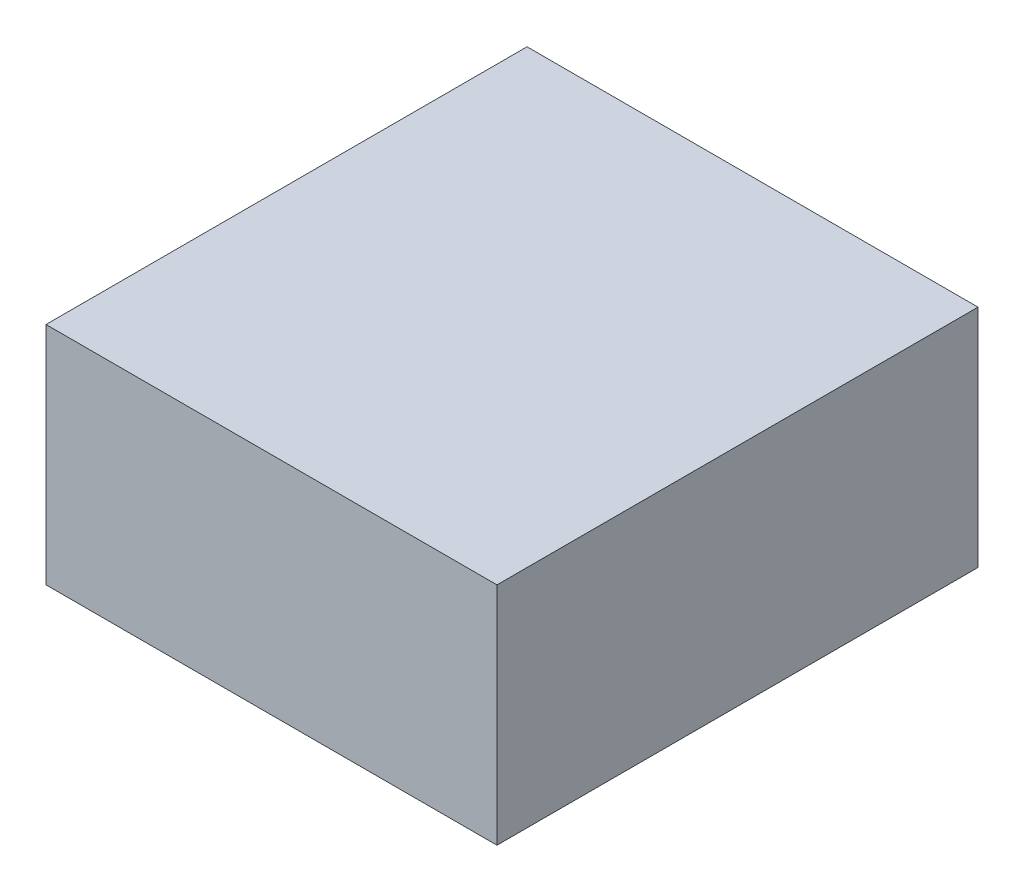
from build123d import *

# Parameters (mm, degrees)
SKETCH_1_W          = 300
SKETCH_1_H          = 150
EXTRUDE_1_DEPTH     = 160
CUT_EXTRUDE_1_DEPTH = 1


with BuildPart() as part:
    # 草图1 → 凸台-拉伸1 (new, symmetric)
    with BuildSketch(Plane.XY):
        Rectangle(SKETCH_1_W, SKETCH_1_H)
    extrude(amount=EXTRUDE_1_DEPTH, both=True)

    # 草图2 → 切除-拉伸1 (cut)
    with BuildSketch(Plane.ZY.offset(150)):
        with BuildLine():
            Line((-95.006009615, 17.135416667), (-50.114182692, 17.135416667))
            Line((-50.114182692, 17.135416667), (-46.057692308, 21.282051282))
            Line((-46.057692308, 21.282051282), (-40.378605769, 15.512820513))
            Line((-40.378605769, 15.512820513), (-65.799278846, 15.512820513))
            Line((-65.799278846, 15.512820513), (-65.799278846, -28.377403846))
            Line((-65.799278846, -28.377403846), (-47.680288462, -28.377403846))
            Line((-47.680288462, -28.377403846), (-43.082932692, -23.780048077))
            Line((-43.082932692, -23.780048077), (-36.862980769, -30))
            Line((-36.862980769, -30), (-89.867788462, -30))
            add(Edge.make_bspline(
                [(-89.867788462, -30), (-90.442370053, -30.009381661), (-91.570188382, -30.027796469), (-93.23036351, -30.179819583), (-94.823305818, -30.436762653), (-95.852103301, -30.687807881), (-96.358173077, -30.811298077)],
                knots=[0, 0, 0, 0, 1.051078301, 2.063110603, 3.047236021, 4, 4, 4, 4], degree=3))
            Line((-96.358173077, -30.811298077), (-98.792067308, -28.377403846))
            Line((-98.792067308, -28.377403846), (-69.855769231, -28.377403846))
            Line((-69.855769231, -28.377403846), (-69.855769231, 15.512820513))
            Line((-69.855769231, 15.512820513), (-86.081730769, 15.512820513))
            add(Edge.make_bspline(
                [(-86.081730769, 15.512820513), (-86.65631236, 15.503438852), (-87.78413069, 15.485024044), (-89.444305818, 15.33300093), (-91.037248126, 15.07605786), (-92.066045609, 14.825012632), (-92.572115385, 14.701522436)],
                knots=[0, 0, 0, 0, 1.051078301, 2.063110603, 3.047236021, 4, 4, 4, 4], degree=3))
            Line((-92.572115385, 14.701522436), (-95.006009615, 17.135416667))
        make_face()
        with BuildLine():
            Line((-4.681490385, -9.787660256), (19.116586538, -9.787660256))
            Line((19.116586538, -9.787660256), (22.361778846, -6.542467949))
            Line((22.361778846, -6.542467949), (27.229567308, -11.41025641))
            Line((27.229567308, -11.41025641), (12.355769231, -11.41025641))
            Line((12.355769231, -11.41025641), (12.355769231, -29.659455128))
            Line((12.355769231, -29.659455128), (24.525240385, -29.659455128))
            Line((24.525240385, -29.659455128), (28.040865385, -26.143830128))
            Line((28.040865385, -26.143830128), (33.179086538, -31.282051282))
            Line((33.179086538, -31.282051282), (-1.165865385, -31.282051282))
            add(Edge.make_bspline(
                [(-1.165865385, -31.282051282), (-1.740446976, -31.291432943), (-2.868265305, -31.309847751), (-4.528440433, -31.461870865), (-6.121382742, -31.718813935), (-7.150180224, -31.969859163), (-7.65625, -32.093349359)],
                knots=[0, 0, 0, 0, 1.051078301, 2.063110603, 3.047236021, 4, 4, 4, 4], degree=3))
            Line((-7.65625, -32.093349359), (-10.090144231, -29.659455128))
            Line((-10.090144231, -29.659455128), (8.569711538, -29.659455128))
            Line((8.569711538, -29.659455128), (8.569711538, -11.41025641))
            Line((8.569711538, -11.41025641), (0.456730769, -11.41025641))
            Line((0.456730769, -11.41025641), (-2.518028846, -11.951121795))
            Line((-2.518028846, -11.951121795), (-4.681490385, -9.787660256))
        make_face()
        with BuildLine():
            add(Edge.make_bspline(
                [(7.758413462, 3.313301282), (7.067265219, 2.665342126), (5.713441333, 1.396117192), (3.667309782, -0.409024252), (1.658486763, -2.081594188), (-0.318793473, -3.618739462), (-2.262000921, -5.023676297), (-4.171867171, -6.295252031), (-6.047139285, -7.437215951), (-7.309086348, -8.107473192), (-7.926682692, -8.435496795)],
                knots=[0, 0, 0, 0, 1.156336434, 2.26503634, 3.329987673, 4.346491992, 5.321449847, 6.25617807, 7.146574306, 8, 8, 8, 8], degree=3))
            Line((-7.926682692, -8.435496795), (-8.467548077, -7.634214744))
            add(Edge.make_bspline(
                [(-8.467548077, -7.634214744), (-7.69738135, -7.013211807), (-6.177930791, -5.788044287), (-4.029200783, -3.862344293), (-2.01692921, -1.907681593), (-0.159106331, 0.087261462), (1.57588225, 2.098242314), (3.144572291, 4.158001254), (4.591303844, 6.239812834), (5.443102287, 7.678293836), (5.865384615, 8.391426282)],
                knots=[0, 0, 0, 0, 1.097558762, 2.165357468, 3.200105271, 4.20915088, 5.189137413, 6.145661431, 7.080704579, 8, 8, 8, 8], degree=3))
            Line((5.865384615, 8.391426282), (10.462740385, 4.114583333))
            Line((10.462740385, 4.114583333), (7.758413462, 3.313301282))
        make_face()
        with BuildLine():
            Line((13.978365385, 5.426682692), (14.519230769, 6.227964744))
            add(Edge.make_bspline(
                [(14.519230769, 6.227964744), (15.167217568, 5.968288295), (16.415465376, 5.468061196), (18.207309655, 4.736310179), (19.829446243, 4.014935701), (21.30316344, 3.364571381), (22.609972818, 2.734189121), (23.748626145, 2.126839151), (24.745622808, 1.588926724), (25.580591421, 1.056551314), (26.294174113, 0.550255631), (26.912246157, 0.050625612), (27.432838524, -0.461096037), (27.873530348, -0.97242665), (28.212033368, -1.498201373), (28.485555723, -2.019424407), (28.642978593, -2.557957207), (28.744059054, -3.246440506), (28.732526094, -4.053274649), (28.618511147, -4.932592671), (28.350192704, -5.69226447), (27.934532191, -6.278936389), (27.507656771, -6.718303712), (27.168390018, -7.050337487), (26.916837611, -7.27820396), (26.750386126, -7.333335264), (26.688701923, -7.353766026)],
                knots=[0, 0, 0, 0, 2.222387381, 4.281090571, 6.16104692, 7.873717546, 9.409149256, 10.778394997, 11.982114518, 13.014137748, 13.928452118, 14.766772039, 15.540917158, 16.249939126, 16.910287843, 17.528216072, 18.116646233, 18.686347911, 19.738588089, 20.67355028, 21.50081465, 22.273206655, 22.942476537, 23.446079015, 23.794725926, 24, 24, 24, 24], degree=3))
            add(Edge.make_bspline(
                [(26.688701923, -7.353766026), (26.593371576, -7.343044478), (26.388611452, -7.320015658), (26.090313674, -7.144088262), (25.770616247, -6.89875826), (25.4530073, -6.529817279), (25.10395244, -6.085597905), (24.74170594, -5.534711555), (24.364229413, -4.884293922), (24.116003935, -4.410106054), (23.984375, -4.158653846)],
                knots=[0, 0, 0, 0, 0.527544467, 1.133113159, 1.886286847, 2.76587534, 3.823244141, 5.026973888, 6.423464563, 8, 8, 8, 8], degree=3))
            add(Edge.make_bspline(
                [(23.984375, -4.158653846), (23.7801829, -3.814065973), (23.348443247, -3.085476333), (22.529578408, -2.011437907), (21.539583185, -0.886631945), (20.369097636, 0.283507751), (19.033064736, 1.511385737), (17.507172151, 2.773753173), (15.813823923, 4.101113011), (14.605860874, 4.973504929), (13.978365385, 5.426682692)],
                knots=[0, 0, 0, 0, 0.688371872, 1.455479582, 2.318090961, 3.264097909, 4.300380693, 5.437681015, 6.668962925, 8, 8, 8, 8], degree=3))
        make_face()
        with BuildLine():
            Line((23.443509615, 5.446714744), (25.877403846, 11.666666667))
            Line((25.877403846, 11.666666667), (-1.436298077, 11.666666667))
            add(Edge.make_bspline(
                [(-1.436298077, 11.666666667), (-1.440314398, 11.279296402), (-1.447900604, 10.547614202), (-1.499331623, 9.505548418), (-1.573008104, 8.581714154), (-1.688104384, 7.773120501), (-1.85859353, 7.066031142), (-2.194181687, 6.490892686), (-2.632346364, 6.016481735), (-3.186050795, 5.712724387), (-3.724374329, 5.479308102), (-4.211592686, 5.327392286), (-4.604772437, 5.196892528), (-4.847736243, 5.182467666), (-4.951923077, 5.176282051)],
                knots=[0, 0, 0, 0, 1.659337105, 3.134229793, 4.469274937, 5.626275952, 6.636097599, 7.558581424, 8.448790264, 9.366159641, 10.237556677, 10.961212527, 11.554551027, 12, 12, 12, 12], degree=3))
            add(Edge.make_bspline(
                [(-4.951923077, 5.176282051), (-5.157746257, 5.200863862), (-5.629445916, 5.25719975), (-6.191570458, 5.507780864), (-6.632917673, 5.758829992), (-6.891169504, 5.930881929), (-7.069270457, 6.088857197), (-7.102115448, 6.209338958), (-7.115384615, 6.258012821)],
                knots=[0, 0, 0, 0, 1.48119583, 3.394562111, 4.36050321, 5.118249749, 5.643778524, 6, 6, 6, 6], degree=3))
            add(Edge.make_bspline(
                [(-7.115384615, 6.258012821), (-7.08994058, 6.417580582), (-7.028264761, 6.804369564), (-6.67194326, 7.405199141), (-6.172245046, 8.154965154), (-5.736334765, 8.672942155), (-5.492788462, 8.962339744)],
                knots=[0, 0, 0, 0, 0.602804915, 1.46118676, 2.581546234, 4, 4, 4, 4], degree=3))
            add(Edge.make_bspline(
                [(-5.492788462, 8.962339744), (-5.315151889, 9.196576078), (-4.952651938, 9.674578205), (-4.476392675, 10.45729072), (-4.043929964, 11.305417058), (-3.6540643, 12.219503302), (-3.303817877, 13.203164758), (-2.99739955, 14.254088874), (-2.720761482, 15.368698066), (-2.586712023, 16.139511816), (-2.518028846, 16.534455128)],
                knots=[0, 0, 0, 0, 0.857780197, 1.750457547, 2.670233957, 3.635223603, 4.649507386, 5.716600804, 6.830050396, 8, 8, 8, 8], degree=3))
            Line((-2.518028846, 16.534455128), (-1.436298077, 16.534455128))
            Line((-1.436298077, 16.534455128), (-1.436298077, 13.289262821))
            Line((-1.436298077, 13.289262821), (25.877403846, 13.289262821))
            Line((25.877403846, 13.289262821), (28.040865385, 15.993589744))
            Line((28.040865385, 15.993589744), (32.367788462, 11.666666667))
            add(Edge.make_bspline(
                [(32.367788462, 11.666666667), (32.084876393, 11.642102561), (31.490388043, 11.590485553), (30.587940353, 11.248828137), (29.647493348, 10.709676261), (28.663372552, 9.949262777), (27.622999488, 8.993311791), (26.534615711, 7.823172057), (25.391985382, 6.448093207), (24.646796462, 5.437465723), (24.254807692, 4.905849359)],
                knots=[0, 0, 0, 0, 0.624762377, 1.31282471, 2.108641581, 3.014257539, 4.053041353, 5.226914023, 6.54128459, 8, 8, 8, 8], degree=3))
            Line((24.254807692, 4.905849359), (23.443509615, 5.446714744))
        make_face()
        with BuildLine():
            Line((5.054086538, 23.966346154), (5.594951923, 24.787660256))
            add(Edge.make_bspline(
                [(5.594951923, 24.787660256), (6.049118452, 24.587588037), (6.921776139, 24.203159531), (8.174077157, 23.646788285), (9.308734591, 23.114337858), (10.326096801, 22.614741677), (11.233690921, 22.155492813), (12.022136461, 21.722625205), (12.706372642, 21.338660886), (13.278112471, 20.971130105), (13.764348158, 20.621727901), (14.15443443, 20.245340599), (14.487551365, 19.865029693), (14.727470906, 19.45207644), (14.889270647, 19.024950509), (14.986004112, 18.582633626), (14.991299143, 18.121375813), (14.907243908, 17.514528961), (14.722193124, 16.831415279), (14.483707425, 16.120913458), (14.201034738, 15.572602072), (13.786994813, 15.112619977), (13.266209516, 14.757853143), (12.820440235, 14.676761108), (12.626201923, 14.641426282)],
                knots=[0, 0, 0, 0, 1.971005274, 3.78718552, 5.442142868, 6.948379248, 8.288584754, 9.481213346, 10.520635333, 11.403371319, 12.180389358, 12.893209359, 13.55193343, 14.181869875, 14.777815506, 15.360333856, 15.970420313, 16.598679906, 17.7885781, 18.774169935, 19.5752527, 20.213920393, 21.22173846, 22, 22, 22, 22], degree=3))
            add(Edge.make_bspline(
                [(12.626201923, 14.641426282), (12.487255777, 14.670620993), (12.166773663, 14.737959188), (11.757048333, 15.159056904), (11.363600641, 15.77512536), (11.133498763, 16.279680672), (11.003605769, 16.564503205)],
                knots=[0, 0, 0, 0, 0.637804645, 1.47110939, 2.572435941, 4, 4, 4, 4], degree=3))
            add(Edge.make_bspline(
                [(11.003605769, 16.564503205), (10.876135249, 16.803112562), (10.603714947, 17.313050337), (10.111471562, 18.088922378), (9.515859913, 18.921714766), (8.818737248, 19.812548005), (8.034055555, 20.776707493), (7.12149966, 21.779928888), (6.138732549, 22.869734565), (5.424393713, 23.591953831), (5.054086538, 23.966346154)],
                knots=[0, 0, 0, 0, 0.681165141, 1.455734343, 2.312029879, 3.258982338, 4.304417023, 5.441970212, 6.673939121, 8, 8, 8, 8], degree=3))
        make_face()
        with BuildLine():
            Line((-6.304086538, -1.344150641), (-15.228365385, -6.752804487))
            Line((-15.228365385, -6.752804487), (-15.228365385, -30.290464744))
            add(Edge.make_bspline(
                [(-15.228365385, -30.290464744), (-15.264789093, -30.642744359), (-15.336589215, -31.337174462), (-15.622916602, -32.342479048), (-16.063092802, -33.283432273), (-16.634681481, -34.170825289), (-17.362519597, -34.99086706), (-18.225989322, -35.751987297), (-19.239746848, -36.44585744), (-19.981909259, -36.844603946), (-20.366586538, -37.051282051)],
                knots=[0, 0, 0, 0, 0.951282364, 1.875212421, 2.79533767, 3.736905861, 4.704203426, 5.734873166, 6.825940502, 8, 8, 8, 8], degree=3))
            add(Edge.make_bspline(
                [(-20.366586538, -37.051282051), (-20.39379497, -36.79953398), (-20.450975477, -36.27046701), (-20.890829858, -35.514626358), (-21.573407297, -34.797134968), (-22.508264913, -34.08427096), (-23.695250629, -33.379256368), (-25.151281569, -32.699250749), (-26.854764512, -32.005798102), (-28.092926062, -31.591864124), (-28.75, -31.372195513)],
                knots=[0, 0, 0, 0, 0.567410724, 1.192455101, 1.93008711, 2.801753461, 3.841774178, 5.047670883, 6.433242804, 8, 8, 8, 8], degree=3))
            Line((-28.75, -31.372195513), (-28.75, -30.290464744))
            add(Edge.make_bspline(
                [(-28.75, -30.290464744), (-28.276110619, -30.375061439), (-27.369411279, -30.536921508), (-26.071412999, -30.75034827), (-24.898557418, -30.909130959), (-23.856867725, -31.031404794), (-22.941834679, -31.114159691), (-22.153274879, -31.155984562), (-21.487548243, -31.161386267), (-20.934028439, -31.120737514), (-20.460552561, -31.002108065), (-20.053229378, -30.766560946), (-19.734452457, -30.3944783), (-19.455719817, -29.937947908), (-19.266393987, -29.361567436), (-19.115834877, -28.687947638), (-19.029251578, -27.902114263), (-19.019568792, -27.342609539), (-19.014423077, -27.045272436)],
                knots=[0, 0, 0, 0, 1.808220358, 3.459693913, 4.940655569, 6.253580308, 7.399219139, 8.391232753, 9.218943302, 9.899057853, 10.471018597, 11.038839643, 11.633582565, 12.291719892, 13.037465463, 13.898517392, 14.883210947, 16, 16, 16, 16], degree=3))
            Line((-19.014423077, -27.045272436), (-19.014423077, -8.645833333))
            add(Edge.make_bspline(
                [(-19.014423077, -8.645833333), (-19.609374009, -8.991913183), (-20.736379143, -9.647486184), (-22.319164047, -10.591466608), (-23.685860879, -11.462800897), (-24.836306748, -12.253398503), (-25.78803402, -12.948128297), (-26.516576045, -13.569663064), (-27.066996434, -14.087288139), (-27.299336452, -14.451121966), (-27.397836538, -14.60536859)],
                knots=[0, 0, 0, 0, 1.596009153, 3.023292197, 4.273176395, 5.353314463, 6.260656545, 7.002131711, 7.576955733, 8, 8, 8, 8], degree=3))
            Line((-27.397836538, -14.60536859), (-30.643028846, -9.727564103))
            add(Edge.make_bspline(
                [(-30.643028846, -9.727564103), (-30.345173406, -9.649937782), (-29.691673126, -9.479624217), (-28.641131383, -9.14243811), (-27.431136632, -8.718923382), (-26.058859805, -8.217844081), (-24.524532121, -7.632877124), (-22.824851142, -6.977476087), (-20.969917534, -6.222335449), (-19.68494984, -5.682394881), (-19.014423077, -5.400641026)],
                knots=[0, 0, 0, 0, 0.594885919, 1.30519058, 2.131778393, 3.072962133, 4.12892683, 5.305816866, 6.59411104, 8, 8, 8, 8], degree=3))
            Line((-19.014423077, -5.400641026), (-19.014423077, 9.743589744))
            Line((-19.014423077, 9.743589744), (-24.693509615, 9.743589744))
            Line((-24.693509615, 9.743589744), (-27.938701923, 9.202724359))
            Line((-27.938701923, 9.202724359), (-30.102163462, 11.366185897))
            Line((-30.102163462, 11.366185897), (-19.014423077, 11.366185897))
            add(Edge.make_bspline(
                [(-19.014423077, 11.366185897), (-19.012427142, 12.16413824), (-19.008560466, 13.709992045), (-19.035565187, 15.953522225), (-19.05152009, 18.050280461), (-19.080516448, 20.003488977), (-19.125211934, 21.812870524), (-19.156533017, 23.476028778), (-19.22267763, 24.99142039), (-19.264811258, 25.952862937), (-19.284855769, 26.41025641)],
                knots=[0, 0, 0, 0, 1.272643643, 2.465461797, 3.57841033, 4.61688262, 5.580919197, 6.465104001, 7.269793692, 8, 8, 8, 8], degree=3))
            Line((-19.284855769, 26.41025641), (-12.524038462, 23.405448718))
            Line((-12.524038462, 23.405448718), (-15.228365385, 21.211939103))
            Line((-15.228365385, 21.211939103), (-15.228365385, 11.366185897))
            Line((-15.228365385, 11.366185897), (-13.064903846, 11.366185897))
            Line((-13.064903846, 11.366185897), (-10.360576923, 14.070512821))
            Line((-10.360576923, 14.070512821), (-6.033653846, 9.743589744))
            Line((-6.033653846, 9.743589744), (-15.228365385, 9.743589744))
            Line((-15.228365385, 9.743589744), (-15.228365385, -4.048477564))
            Line((-15.228365385, -4.048477564), (-6.844951923, -0.262419872))
            Line((-6.844951923, -0.262419872), (-6.304086538, -1.344150641))
        make_face()
        with BuildLine():
            Line((72.932692308, 18.076923077), (72.932692308, -5.430689103))
            add(Edge.make_bspline(
                [(72.932692308, -5.430689103), (72.921837682, -6.25237814), (72.900454566, -7.871067933), (72.710379536, -10.264012035), (72.428093023, -12.582134248), (72.017029833, -14.830711628), (71.474416248, -16.999567619), (70.823615338, -19.096712959), (70.062332645, -21.124006848), (69.168135378, -23.070936788), (68.169999928, -24.954943974), (67.029416659, -26.747382617), (65.785440165, -28.473094073), (64.433731048, -30.13443879), (62.943797615, -31.706981851), (61.337609592, -33.2067815), (59.627565724, -34.650072555), (58.405561824, -35.526808176), (57.788461538, -35.969551282)],
                knots=[0, 0, 0, 0, 1.108626279, 2.183943025, 3.237300058, 4.258815003, 5.266274601, 6.252363065, 7.220493292, 8.186198952, 9.141582016, 10.095274576, 11.05056203, 12.011041014, 12.983104791, 13.971187867, 14.975469272, 16, 16, 16, 16], degree=3))
            Line((57.788461538, -35.969551282), (56.977163462, -35.158253205))
            add(Edge.make_bspline(
                [(56.977163462, -35.158253205), (57.473092718, -34.692729075), (58.459923422, -33.766400374), (59.841258609, -32.291482504), (61.125613753, -30.754329782), (62.319893307, -29.162230984), (63.415462087, -27.507574526), (64.40022628, -25.787440114), (65.32608093, -24.026822479), (66.116802687, -22.188958313), (66.834581271, -20.299222214), (67.453948319, -18.349995854), (67.972981061, -16.339455799), (68.407219601, -14.274846683), (68.732836651, -12.147592967), (68.975662072, -9.962562457), (69.115771586, -7.716186109), (69.13626252, -6.198772907), (69.146634615, -5.430689103)],
                knots=[0, 0, 0, 0, 0.985314845, 1.960640411, 2.925594497, 3.886283397, 4.842871568, 5.798676654, 6.757109883, 7.723227236, 8.695332628, 9.685137536, 10.684763635, 11.702725791, 12.740583817, 13.80148723, 14.887157401, 16, 16, 16, 16], degree=3))
            Line((69.146634615, -5.430689103), (69.146634615, 7.540064103))
            add(Edge.make_bspline(
                [(69.146634615, 7.540064103), (69.133696452, 9.994179336), (69.107569583, 14.949932817), (68.953815948, 19.903374759), (68.876201923, 22.403846154)],
                knots=[0, 0, 0, 0, 0.990410537, 2, 2, 2, 2], degree=3))
            Line((68.876201923, 22.403846154), (72.932692308, 19.699519231))
            Line((72.932692308, 19.699519231), (85.372596154, 19.699519231))
            Line((85.372596154, 19.699519231), (87.806490385, 22.403846154))
            Line((87.806490385, 22.403846154), (92.133413462, 18.617788462))
            Line((92.133413462, 18.617788462), (89.429086538, 16.985176282))
            Line((89.429086538, 16.985176282), (89.429086538, -27.245592949))
            add(Edge.make_bspline(
                [(89.429086538, -27.245592949), (89.4346101, -27.460143011), (89.44500177, -27.863783503), (89.577756096, -28.423428135), (89.786902562, -28.90370737), (90.097037816, -29.287786097), (90.478539796, -29.607843447), (90.963722972, -29.808313962), (91.521640425, -29.943931153), (91.922112492, -29.954408001), (92.133413462, -29.959935897)],
                knots=[0, 0, 0, 0, 1.17022464, 2.201584301, 3.124385285, 4.007915669, 4.87719616, 5.81662875, 6.847988411, 8, 8, 8, 8], degree=3))
            Line((92.133413462, -29.959935897), (95.378605769, -29.959935897))
            add(Edge.make_bspline(
                [(95.378605769, -29.959935897), (95.59230123, -29.931281124), (96.029238052, -29.872691552), (96.599225273, -29.411719457), (97.005019129, -28.690043811), (97.256783425, -27.916204478), (97.419322884, -27.118998519), (97.530186394, -26.321866626), (97.657309729, -25.358229783), (97.746459183, -24.224357508), (97.851528954, -22.922892958), (97.937973528, -21.453443071), (98.019174292, -19.814125305), (98.060954335, -18.665258092), (98.082932692, -18.060897436)],
                knots=[0, 0, 0, 0, 0.593285662, 1.213073742, 1.959102594, 2.885957232, 3.477257056, 4.23234027, 5.135388809, 6.194265944, 7.411285708, 8.785969923, 10.309262111, 12, 12, 12, 12], degree=3))
            Line((98.082932692, -18.060897436), (99.435096154, -18.060897436))
            add(Edge.make_bspline(
                [(99.435096154, -18.060897436), (99.438229752, -18.534978634), (99.444254469, -19.446456553), (99.456143414, -20.752402701), (99.511176889, -21.934164305), (99.570861164, -22.992591233), (99.635864369, -23.92841939), (99.724843563, -24.743845136), (99.832041377, -25.436641055), (99.997414425, -26.187588898), (100.305386832, -27.01497505), (100.912092067, -27.858224803), (101.697071221, -28.605072419), (102.34327116, -28.962319947), (102.680288462, -29.148637821)],
                knots=[0, 0, 0, 0, 1.392277126, 2.676819629, 3.834791772, 4.865946343, 5.79012363, 6.58917741, 7.274232445, 7.847440921, 8.84702178, 9.839799572, 10.873375133, 12, 12, 12, 12], degree=3))
            add(Edge.make_bspline(
                [(102.680288462, -29.148637821), (102.546896485, -29.407671197), (102.293394288, -29.899946155), (101.875771368, -30.575193071), (101.470315763, -31.170796051), (101.050224805, -31.677079996), (100.615502531, -32.087959237), (100.190185825, -32.426499598), (99.748052328, -32.664967315), (98.887760157, -32.940366372), (97.604097899, -33.131767636), (96.47068302, -33.18112454), (95.919471154, -33.205128205)],
                knots=[0, 0, 0, 0, 1.024250653, 1.9465173, 2.790090786, 3.556785589, 4.254377239, 4.890791374, 5.463349847, 6.009159617, 8.059140908, 10, 10, 10, 10], degree=3))
            Line((95.919471154, -33.205128205), (90.240384615, -33.205128205))
            add(Edge.make_bspline(
                [(90.240384615, -33.205128205), (89.87880763, -33.192636554), (89.199421052, -33.169165314), (88.247767373, -32.971809471), (87.439884955, -32.632999723), (86.772443618, -32.150006259), (86.257432141, -31.51764032), (85.898915858, -30.746806938), (85.674027125, -29.848938224), (85.653732846, -29.206851068), (85.643028846, -28.868189103)],
                knots=[0, 0, 0, 0, 1.197894128, 2.250788146, 3.20273384, 4.081608432, 4.954608877, 5.875416252, 6.87941115, 8, 8, 8, 8], degree=3))
            Line((85.643028846, -28.868189103), (85.643028846, 18.076923077))
            Line((85.643028846, 18.076923077), (72.932692308, 18.076923077))
        make_face()
        with BuildLine():
            add(Edge.make_bspline(
                [(54.813701923, -0.773237179), (54.81398025, -1.93175704), (54.814522465, -4.188700629), (54.810687325, -7.48398448), (54.824092531, -10.602297038), (54.833328287, -13.543670724), (54.84320517, -16.311434519), (54.8543161, -18.902238996), (54.860314995, -21.316150132), (54.883633302, -23.553022021), (54.902951973, -25.616327172), (54.922522129, -27.502688178), (54.94384868, -29.212068257), (54.959652297, -30.744656896), (54.992208925, -32.100073498), (55.02176792, -33.278638661), (55.050925823, -34.280287385), (55.073771683, -34.891171045), (55.084134615, -35.168269231)],
                knots=[0, 0, 0, 0, 1.616663304, 3.14946511, 4.59841291, 5.968158618, 7.254043346, 8.460726103, 9.583548035, 10.622540587, 11.582334062, 12.462929081, 13.25500914, 13.967892764, 14.601667102, 15.146945995, 15.613052807, 16, 16, 16, 16], degree=3))
            Line((55.084134615, -35.168269231), (50.757211538, -37.051282051))
            add(Edge.make_bspline(
                [(50.757211538, -37.051282051), (50.777223446, -36.019632984), (50.819124723, -33.859548344), (50.885141167, -30.477635363), (50.916706493, -26.808211891), (50.961472804, -22.851964402), (50.990502819, -18.608470852), (51.00638725, -14.081194498), (51.033475466, -9.270191766), (51.0296256, -5.968219976), (51.027644231, -4.268830128)],
                knots=[0, 0, 0, 0, 0.755372881, 1.581612788, 2.476211096, 3.441684722, 4.478014026, 5.582763334, 6.755947139, 8, 8, 8, 8], degree=3))
            add(Edge.make_bspline(
                [(51.027644231, -4.268830128), (50.679857473, -5.200751106), (49.988644272, -7.052909274), (48.790439393, -9.749260597), (47.470494062, -12.357681484), (46.056467342, -14.897659216), (44.498251762, -17.338619806), (42.831586523, -19.699058401), (41.051565475, -21.980351423), (39.770674597, -23.4259897), (39.128605769, -24.150641026)],
                knots=[0, 0, 0, 0, 1.023436362, 2.034041579, 3.034309397, 4.031101673, 5.024263628, 6.012779382, 7.003871108, 8, 8, 8, 8], degree=3))
            Line((39.128605769, -24.150641026), (38.587740385, -23.349358974))
            add(Edge.make_bspline(
                [(38.587740385, -23.349358974), (39.253889087, -22.27451297), (40.604772286, -20.094832362), (42.439068381, -16.649532658), (44.15107461, -13.021823049), (45.73328101, -9.21070013), (47.1818154, -5.217727647), (48.515781158, -1.045877891), (49.720313582, 3.315211766), (50.407729415, 6.302019928), (50.757211538, 7.820512821)],
                knots=[0, 0, 0, 0, 0.902120954, 1.829411416, 2.783192599, 3.763614176, 4.772747686, 5.813216077, 6.88823933, 8, 8, 8, 8], degree=3))
            Line((50.757211538, 7.820512821), (44.266826923, 7.820512821))
            Line((44.266826923, 7.820512821), (41.832932692, 7.279647436))
            Line((41.832932692, 7.279647436), (39.669471154, 9.443108974))
            Line((39.669471154, 9.443108974), (51.027644231, 9.443108974))
            add(Edge.make_bspline(
                [(51.027644231, 9.443108974), (51.023326244, 10.99561002), (51.01484791, 14.043933327), (50.962194808, 18.531185355), (50.888884834, 22.848491612), (50.800513656, 25.669151186), (50.757211538, 27.051282051)],
                knots=[0, 0, 0, 0, 1.057861585, 2.077102707, 3.057775095, 4, 4, 4, 4], degree=3))
            Line((50.757211538, 27.051282051), (56.706730769, 24.617387821))
            Line((56.706730769, 24.617387821), (54.813701923, 22.714342949))
            Line((54.813701923, 22.714342949), (54.813701923, 9.443108974))
            Line((54.813701923, 9.443108974), (58.599759615, 9.443108974))
            Line((58.599759615, 9.443108974), (61.574519231, 12.41786859))
            Line((61.574519231, 12.41786859), (66.171875, 7.820512821))
            Line((66.171875, 7.820512821), (54.813701923, 7.820512821))
            Line((54.813701923, 7.820512821), (54.813701923, 0.568910256))
            add(Edge.make_bspline(
                [(54.813701923, 0.568910256), (55.331447549, 0.372592469), (56.321666558, -0.002876864), (57.736352852, -0.551230702), (59.011427625, -1.073388479), (60.14679035, -1.560765781), (61.144381917, -2.009961101), (61.999123037, -2.431701244), (62.716195198, -2.816155167), (63.468200374, -3.270962745), (64.224751283, -3.859588259), (64.883076927, -4.707094536), (65.286899293, -5.667742052), (65.335828279, -6.348417593), (65.360576923, -6.692708333)],
                knots=[0, 0, 0, 0, 1.472016443, 2.81531816, 4.033350152, 5.134678953, 6.099880211, 6.941381202, 7.668153446, 8.261825946, 9.277881501, 10.195682921, 11.087363029, 12, 12, 12, 12], degree=3))
            add(Edge.make_bspline(
                [(65.360576923, -6.692708333), (65.343297479, -7.142629052), (65.308331403, -8.053072799), (65.022419811, -9.132768811), (64.793122583, -9.922530959), (64.598046247, -10.327414984), (64.47337423, -10.628544742), (64.328810881, -10.695878427), (64.278846154, -10.719150641)],
                knots=[0, 0, 0, 0, 1.895571212, 3.835811256, 4.710206953, 5.341871525, 5.772534254, 6, 6, 6, 6], degree=3))
            add(Edge.make_bspline(
                [(64.278846154, -10.719150641), (64.203891294, -10.710560029), (64.037442366, -10.691483238), (63.796187698, -10.54164909), (63.53500082, -10.326496725), (63.242829467, -10.030845588), (62.926541653, -9.651324646), (62.588460186, -9.185476352), (62.213612068, -8.645746471), (61.972805104, -8.246715718), (61.844951923, -8.034855769)],
                knots=[0, 0, 0, 0, 0.48279052, 1.072111453, 1.793717756, 2.679214007, 3.751835041, 4.986873208, 6.400221324, 8, 8, 8, 8], degree=3))
            add(Edge.make_bspline(
                [(61.844951923, -8.034855769), (61.40674296, -7.404120588), (60.502534861, -6.102650499), (58.852905231, -4.277809997), (56.96144413, -2.464128457), (55.545036854, -1.349008262), (54.813701923, -0.773237179)],
                knots=[0, 0, 0, 0, 0.906748205, 1.871000228, 2.900731502, 4, 4, 4, 4], degree=3))
        make_face()
    extrude(amount=-CUT_EXTRUDE_1_DEPTH, mode=Mode.SUBTRACT)


solid = part.part
